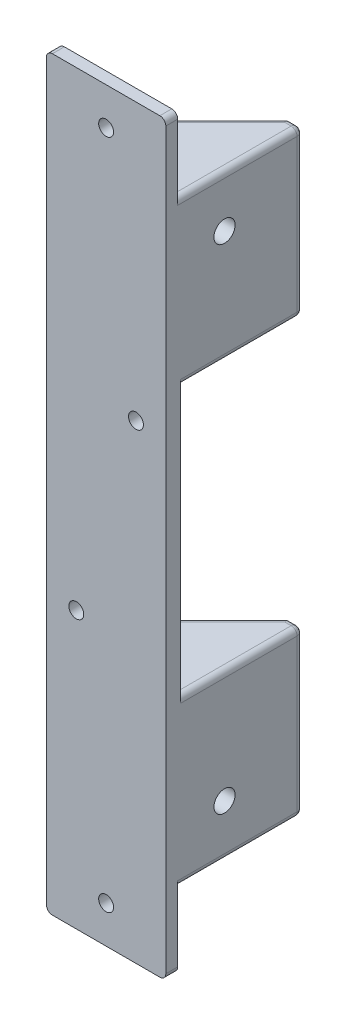
from build123d import *

# Parameters (mm, degrees)
BOSS_EXTRUDE1_DEPTH     = 127
CUT_EXTRUDE1_START      = -31.75
CUT_EXTRUDE1_DEPTH      = 28.575
CUT_EXTRUDE2_START      = 31.75
CUT_EXTRUDE2_DEPTH      = 28.575
SKETCH3_W               = 25.4
SKETCH3_H               = 50.8
CUT_EXTRUDE4_DEPTH      = 28.575
SKETCH6_W               = 25.4
SKETCH6_H               = 15.875
SKETCH6_R               = 1.5875
BOSS_EXTRUDE2_DEPTH     = 2.54
CUT_EXTRUDE6_DEPTH      = 148.432177119
CUT_EXTRUDE6_DEPTH_BACK = 148.432177119
SKETCH5_R               = 1.5875
SKETCH7_R               = 2.25
CUT_EXTRUDE7_DEPTH      = 148.514203892
FILLET1_R               = 1.27


with BuildPart() as part:
    # Sketch1 → Boss-Extrude1 (new body)
    with BuildSketch(Plane(origin=(0, 0, 0), x_dir=(1, 0, 0), z_dir=(0, 1, 0))):
        Polygon((0, 0), (-25.4, 0), (-25.4, 6.985), (-3.175, 29.21), (0, 29.21), align=None)
    extrude(amount=BOSS_EXTRUDE1_DEPTH)

    # Sketch2 → Cut-Extrude1 (cut)
    with BuildSketch(Plane(origin=(0, 63.5, 0), x_dir=(-1, 0, 0), z_dir=(0, -1, 0)).offset(CUT_EXTRUDE1_START)):
        Polygon((25.4, 6.985), (3.175, 29.21), (3.175, 3.175), (25.4, 3.175), align=None)
    extrude(amount=-CUT_EXTRUDE1_DEPTH, mode=Mode.SUBTRACT)

    # Sketch2<2> → Cut-Extrude2 (cut)
    with BuildSketch(Plane(origin=(0, 63.5, 0), x_dir=(-1, 0, 0), z_dir=(0, -1, 0)).offset(CUT_EXTRUDE2_START)):
        Polygon((25.4, 6.985), (3.175, 29.21), (3.175, 3.175), (25.4, 3.175), align=None)
    extrude(amount=CUT_EXTRUDE2_DEPTH, mode=Mode.SUBTRACT)

    # Sketch3 → Cut-Extrude4 (cut, symmetric)
    with BuildSketch(Plane(origin=(0, 63.5, 0), x_dir=(-1, 0, 0), z_dir=(0, -1, 0))):
        with Locations((12.7, 28.575)):
            Rectangle(SKETCH3_W, SKETCH3_H)
    extrude(amount=CUT_EXTRUDE4_DEPTH, both=True, mode=Mode.SUBTRACT)

    # Sketch6 → Boss-Extrude2 (add)
    # profile 1 of 2: a face of its own
    with BuildSketch(Plane.XY):
        with Locations((-12.7, 134.9375)):
            Rectangle(SKETCH6_W, SKETCH6_H)
        with Locations((-12.7, 134.9375)):
            Circle(SKETCH6_R, mode=Mode.SUBTRACT)
    # profile 2 of 2: a face of its own
    with BuildSketch(Plane.XY):
        with Locations((-12.7, -7.9375)):
            Rectangle(SKETCH6_W, SKETCH6_H)
        with Locations(Location((-12.7, -7.9375, 0), (0, 0, 180))):
            Circle(SKETCH6_R, mode=Mode.SUBTRACT)
    extrude(amount=-BOSS_EXTRUDE2_DEPTH)

    # Sketch5 → Cut-Extrude6 (cut, two sides: drawn at the far end of the back side and taken through both)
    with BuildSketch(Plane(origin=(0, 0, -3.175), x_dir=(-1, 0, 0), z_dir=(0, 0, -1)).offset(-CUT_EXTRUDE6_DEPTH_BACK)):
        with Locations((6.35, 84.1375)):
            Circle(SKETCH5_R)
        with Locations((19.05, 42.8625)):
            Circle(SKETCH5_R)
    extrude(amount=CUT_EXTRUDE6_DEPTH + CUT_EXTRUDE6_DEPTH_BACK, mode=Mode.SUBTRACT)

    # Sketch7 → Cut-Extrude7 (cut, through all)
    with BuildSketch(Plane.ZY.offset(3.175)):
        with Locations((-12.49625182, 11)):
            Circle(SKETCH7_R)
        with Locations((-12.49625182, 116)):
            Circle(SKETCH7_R)
    extrude(amount=-CUT_EXTRUDE7_DEPTH, mode=Mode.SUBTRACT)

    # Fillet1
    fillet1_edges = [part.edges().sort_by_distance(p)[0] for p in [
        (-14.2875, 127, -18.0975),
        (-25.4, 127, -4.7625),
        (-3.175, 109.5375, -3.175),
        (-3.175, 95.25, -16.1925),
        (-14.2875, 95.25, -3.175),
        (-14.2875, 123.825, -3.175),
        (-3.175, 123.825, -16.1925),
        (-3.175, 31.75, -16.1925),
        (-3.175, 17.4625, -3.175),
        (-14.2875, 31.75, -3.175),
        (-3.175, 3.175, -16.1925),
        (-14.2875, 3.175, -3.175),
        (0, 17.4625, -29.21),
        (-1.5875, 34.925, -29.21),
        (-1.5875, 92.075, -29.21),
        (-25.4, 92.075, -5.08),
        (0, 92.075, -16.1925),
        (-25.4, 34.925, -5.08),
        (-14.2875, 34.925, -18.0975),
        (0, 34.925, -16.1925),
        (-14.2875, 92.075, -18.0975),
        (0, 127, -15.875),
        (-14.2875, 0, -18.0975),
        (0, 142.875, -1.27),
        (-25.4, 142.875, -1.27),
        (-1.5875, 0, -29.21),
        (0, 0, -15.875),
        (0, -15.875, -1.27),
        (-25.4, -15.875, -1.27),
        (-1.5875, 127, -29.21),
        (0, 109.5375, -29.21),
    ]]
    fillet(fillet1_edges, radius=FILLET1_R)


solid = part.part
